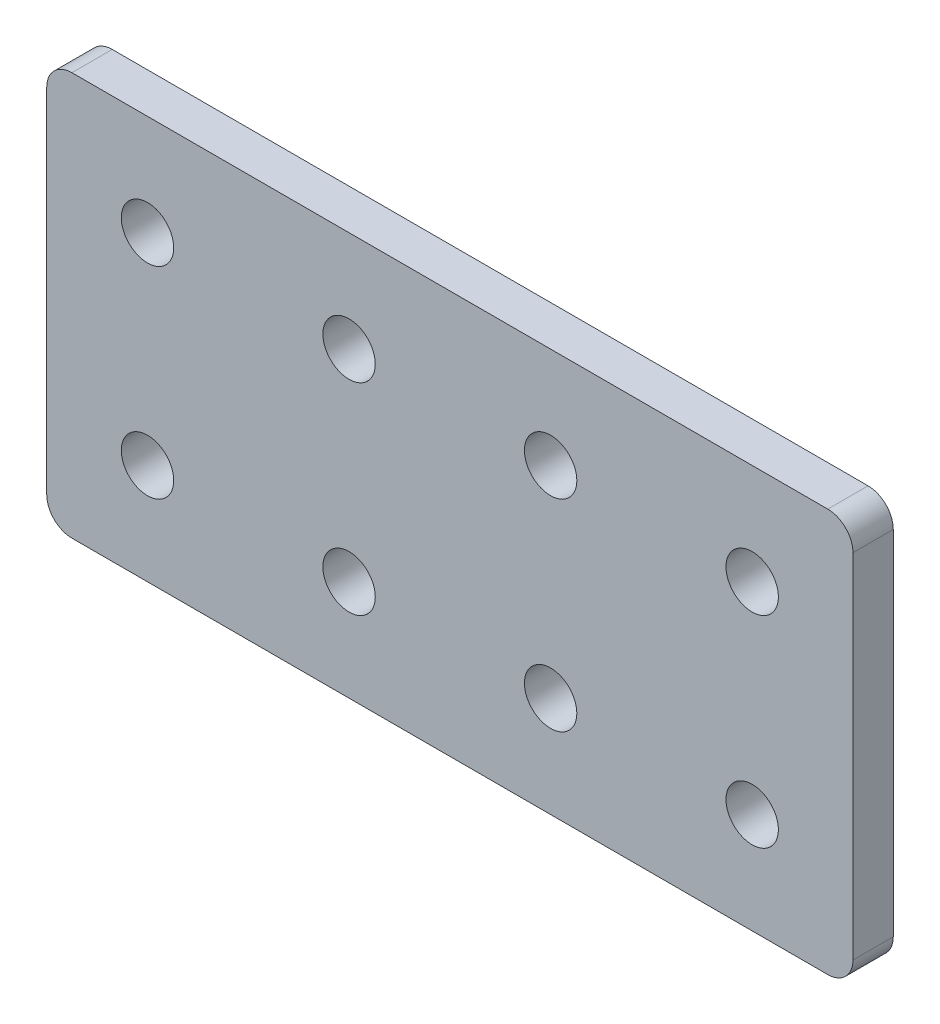
from build123d import *

# Parameters (mm, degrees)
SKETCH_1_R      = 2.6
EXTRUDE_1_DEPTH = 4


with BuildPart() as part:
    # Эскиз1 → Бобышка-Вытянуть1 (new body)
    with BuildSketch(Plane.XY):
        with BuildLine():
            Line((2.5, 0), (77.5, 0))
            ThreePointArc((77.5, 0), (79.267766953, -0.732233047), (80, -2.5))
            Line((80, -2.5), (80, -37.5))
            ThreePointArc((80, -37.5), (79.267766953, -39.267766953), (77.5, -40))
            Line((77.5, -40), (2.5, -40))
            ThreePointArc((2.5, -40), (0.732233047, -39.267766953), (0, -37.5))
            Line((0, -37.5), (0, -2.5))
            ThreePointArc((0, -2.5), (0.732233047, -0.732233047), (2.5, 0))
        make_face()
        with Locations((10, -10)):
            Circle(SKETCH_1_R, mode=Mode.SUBTRACT)
        with Locations((30, -10)):
            Circle(SKETCH_1_R, mode=Mode.SUBTRACT)
        with Locations((50, -10)):
            Circle(SKETCH_1_R, mode=Mode.SUBTRACT)
        with Locations((70, -10)):
            Circle(SKETCH_1_R, mode=Mode.SUBTRACT)
        with Locations((30, -30)):
            Circle(SKETCH_1_R, mode=Mode.SUBTRACT)
        with Locations((50, -30)):
            Circle(SKETCH_1_R, mode=Mode.SUBTRACT)
        with Locations((70, -30)):
            Circle(SKETCH_1_R, mode=Mode.SUBTRACT)
        with Locations((10, -30)):
            Circle(SKETCH_1_R, mode=Mode.SUBTRACT)
    extrude(amount=EXTRUDE_1_DEPTH)


solid = part.part
